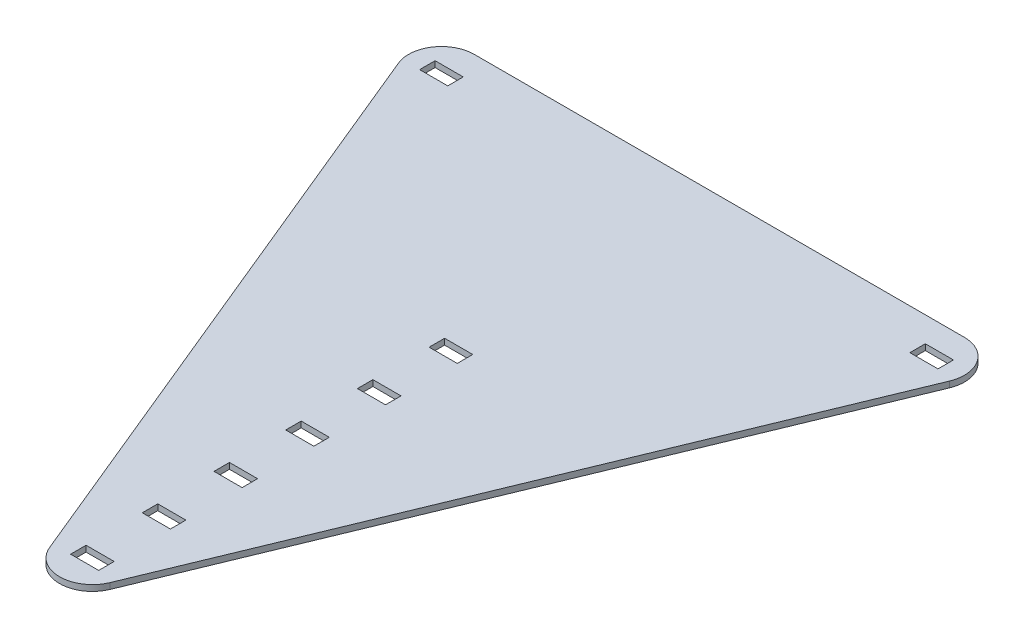
from build123d import *

# Parameters (mm, degrees)
SKETCH1_W           = 30
SKETCH1_H           = 16.5
BOSS_EXTRUDE1_DEPTH = 6.35


with BuildPart() as part:
    # Sketch1 → Boss-Extrude1 (new body)
    with BuildSketch(Plane(origin=(0, 0, 0), x_dir=(1, 0, 0), z_dir=(0, 1, 0))):
        with BuildLine():
            Line((32.354745971, -13.34804904), (293.859745971, 620.52195096))
            ThreePointArc((293.859745971, 620.52195096), (290.592640987, 653.335588658), (261.505, 668.87))
            Line((261.505, 668.87), (-261.505, 668.87))
            ThreePointArc((-261.505, 668.87), (-290.592640987, 653.335588658), (-293.859745971, 620.52195096))
            Line((-293.859745971, 620.52195096), (-32.354745971, -13.34804904))
            ThreePointArc((-32.354745971, -13.34804904), (0, -35), (32.354745971, -13.34804904))
        make_face()
        with Locations((0, 76.5)):
            Rectangle(SKETCH1_W, SKETCH1_H, mode=Mode.SUBTRACT)
        with Locations((261.505, 633.87)):
            Rectangle(SKETCH1_W, SKETCH1_H, mode=Mode.SUBTRACT)
        Rectangle(SKETCH1_W, SKETCH1_H, mode=Mode.SUBTRACT)
        with Locations((0, 153)):
            Rectangle(SKETCH1_W, SKETCH1_H, mode=Mode.SUBTRACT)
        with Locations((0, 229.5)):
            Rectangle(SKETCH1_W, SKETCH1_H, mode=Mode.SUBTRACT)
        with Locations((0, 306)):
            Rectangle(SKETCH1_W, SKETCH1_H, mode=Mode.SUBTRACT)
        with Locations((0, 382.5)):
            Rectangle(SKETCH1_W, SKETCH1_H, mode=Mode.SUBTRACT)
        with Locations((-261.505, 633.87)):
            Rectangle(SKETCH1_W, SKETCH1_H, mode=Mode.SUBTRACT)
    extrude(amount=BOSS_EXTRUDE1_DEPTH)


solid = part.part
